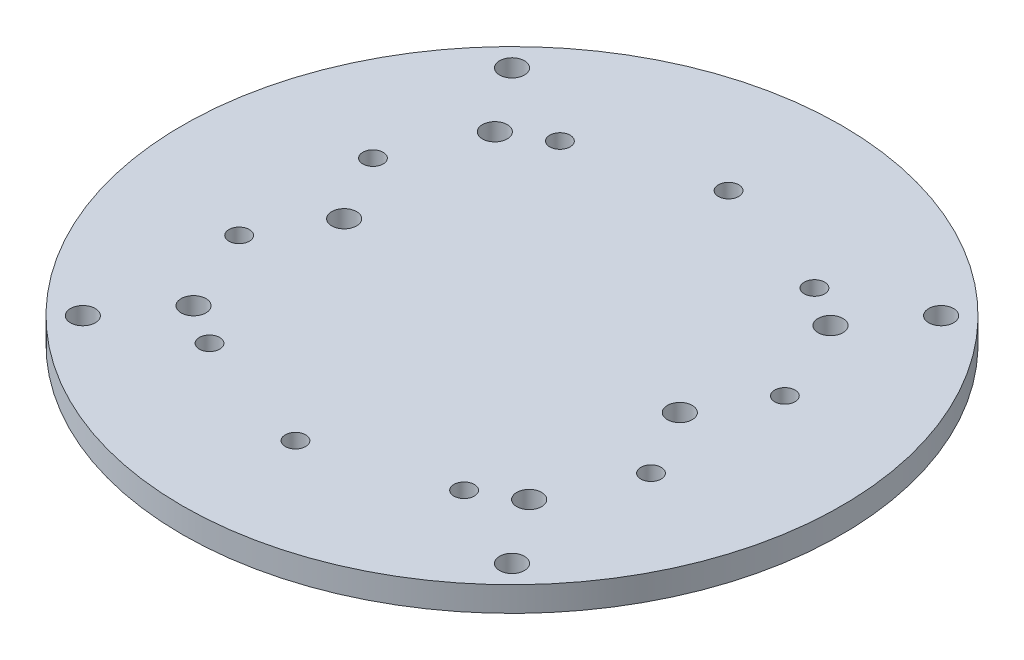
from build123d import *

# Parameters (mm, degrees)
SKETCH1_R           = 84.1675
SKETCH1_R_2         = 3.175
SKETCH1_R_3         = 2.6035
BOSS_EXTRUDE1_DEPTH = 6.35


with BuildPart() as part:
    # Sketch1 → Boss-Extrude1 (new body)
    with BuildSketch(Plane.XZ.offset(66.8)):
        with Locations(Location((0, 0, 0), (0, 0, 270))):
            Circle(SKETCH1_R)
        with Locations(Location((54.800775542, 54.800775542, 0), (0, 0, 270))):
            Circle(SKETCH1_R_2, mode=Mode.SUBTRACT)
        with Locations(Location((54.800775542, -54.800775542, 0), (0, 0, 270))):
            Circle(SKETCH1_R_2, mode=Mode.SUBTRACT)
        with Locations(Location((-54.800775542, -54.800775542, 0), (0, 0, 270))):
            Circle(SKETCH1_R_2, mode=Mode.SUBTRACT)
        with Locations(Location((-54.800775542, 54.800775542, 0), (0, 0, 270))):
            Circle(SKETCH1_R_2, mode=Mode.SUBTRACT)
        with Locations(Location((-42.8625, -38.476238101, 0), (0, 0, 270))):
            Circle(SKETCH1_R_2, mode=Mode.SUBTRACT)
        with Locations(Location((-42.8625, 0, 0), (0, 0, 270))):
            Circle(SKETCH1_R_2, mode=Mode.SUBTRACT)
        with Locations(Location((-42.8625, 38.476238101, 0), (0, 0, 270))):
            Circle(SKETCH1_R_2, mode=Mode.SUBTRACT)
        with Locations(Location((42.8625, 38.476238101, 0), (0, 0, 270))):
            Circle(SKETCH1_R_2, mode=Mode.SUBTRACT)
        with Locations(Location((42.8625, 0, 0), (0, 0, 270))):
            Circle(SKETCH1_R_2, mode=Mode.SUBTRACT)
        with Locations(Location((42.8625, -38.476238101, 0), (0, 0, 270))):
            Circle(SKETCH1_R_2, mode=Mode.SUBTRACT)
        with Locations(Location((-52.598201949, -17.0901918, 0), (0, 0, 270))):
            Circle(SKETCH1_R_3, mode=Mode.SUBTRACT)
        with Locations(Location((-52.598201949, 17.0901918, 0), (0, 0, 270))):
            Circle(SKETCH1_R_3, mode=Mode.SUBTRACT)
        with Locations(Location((-32.507476552, 44.742703006, 0), (0, 0, 270))):
            Circle(SKETCH1_R_3, mode=Mode.SUBTRACT)
        with Locations(Location((0, 55.305022413, 0), (0, 0, 270))):
            Circle(SKETCH1_R_3, mode=Mode.SUBTRACT)
        with Locations(Location((32.507476552, 44.742703006, 0), (0, 0, 270))):
            Circle(SKETCH1_R_3, mode=Mode.SUBTRACT)
        with Locations(Location((52.598201949, 17.0901918, 0), (0, 0, 270))):
            Circle(SKETCH1_R_3, mode=Mode.SUBTRACT)
        with Locations(Location((52.598201949, -17.0901918, 0), (0, 0, 270))):
            Circle(SKETCH1_R_3, mode=Mode.SUBTRACT)
        with Locations(Location((32.507476552, -44.742703006, 0), (0, 0, 270))):
            Circle(SKETCH1_R_3, mode=Mode.SUBTRACT)
        with Locations(Location((0, -55.305022413, 0), (0, 0, 270))):
            Circle(SKETCH1_R_3, mode=Mode.SUBTRACT)
        with Locations(Location((-32.507476552, -44.742703006, 0), (0, 0, 270))):
            Circle(SKETCH1_R_3, mode=Mode.SUBTRACT)
    extrude(amount=BOSS_EXTRUDE1_DEPTH)


solid = part.part
